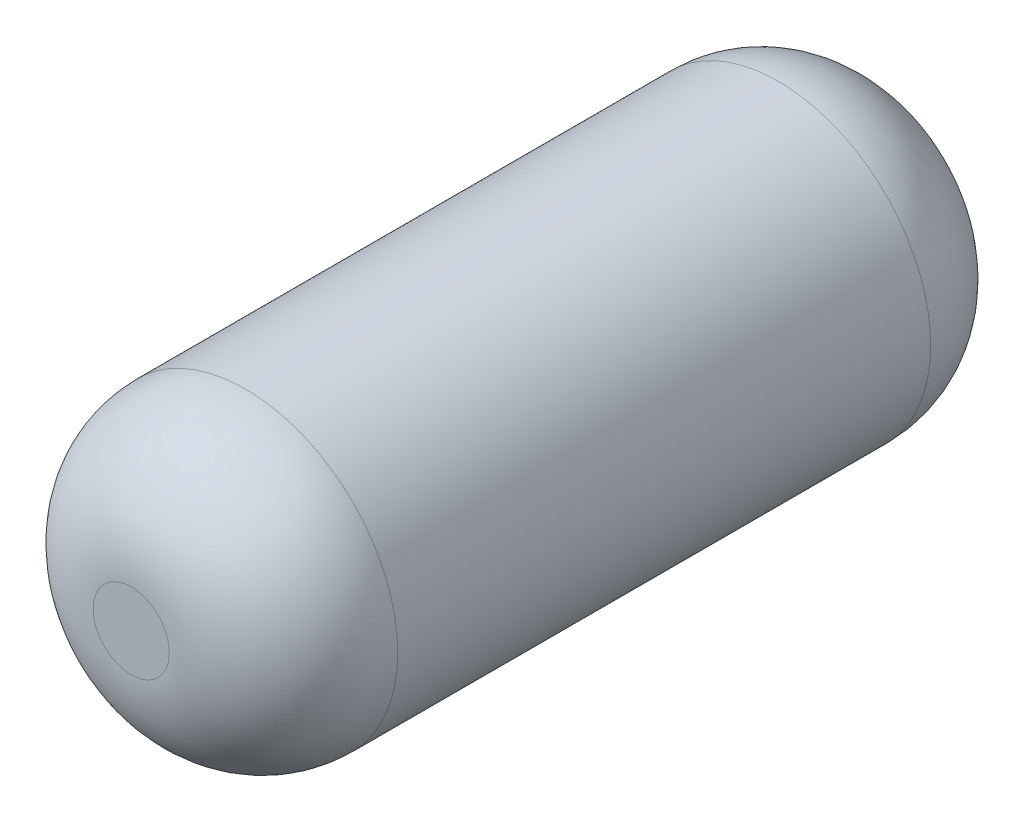
from build123d import *

# Parameters (mm, degrees)
CROQUIS1_R              = 4
SALIENTE_EXTRUIR1_DEPTH = 20
REDONDEO1_R             = 3


with BuildPart() as part:
    # Croquis1 → Saliente-Extruir1 (new body)
    with BuildSketch(Plane.XY):
        Circle(CROQUIS1_R)
    extrude(amount=SALIENTE_EXTRUIR1_DEPTH)

    # Redondeo1
    redondeo1_edges = [part.edges().sort_by_distance(p)[0] for p in [
        (-4, 0, 0),
        (-4, 0, 20),
    ]]
    fillet(redondeo1_edges, radius=REDONDEO1_R)


solid = part.part
